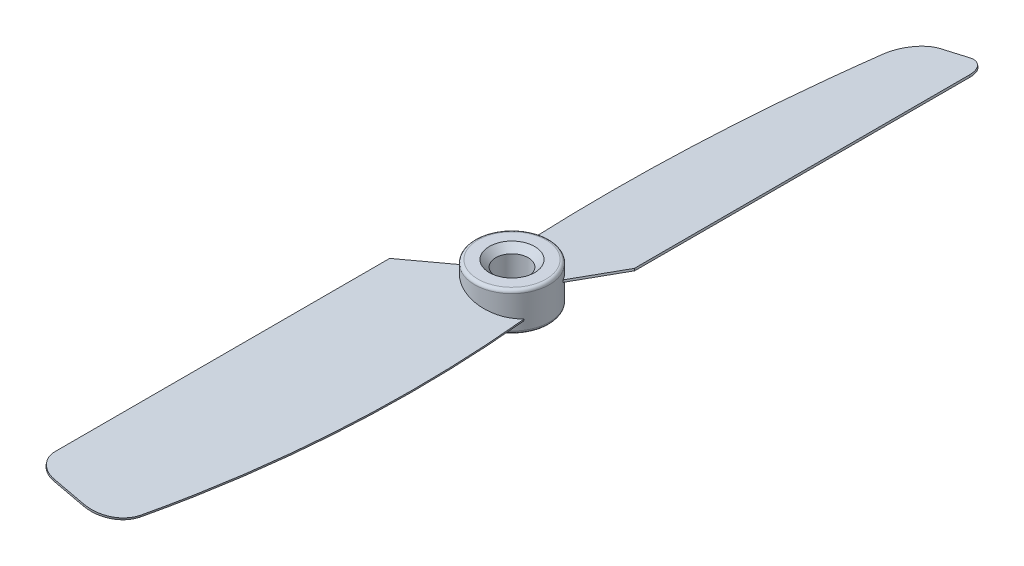
from build123d import *

# Parameters (mm, degrees)
SKETCH1_R            = 5.75
BOSS_EXTRUDE2_DEPTH  = 3
BOSS_EXTRUDE10_DEPTH = 0.15
CIRPATTERN1_COUNT    = 2
SKETCH5_R            = 2.5
CUT_EXTRUDE1_DEPTH   = 65.589571664
FILLET1_R            = 0.5
CHAMFER1_SIZE        = 1


with BuildPart() as part:
    # Sketch1 → Boss-Extrude2 (new, symmetric)
    with BuildSketch(Plane(origin=(0, 0, 0), x_dir=(1, 0, 0), z_dir=(0, 1, 0))):
        with Locations(Location((0, 0, 0), (0, 0, 270))):
            Circle(SKETCH1_R)
    extrude(amount=BOSS_EXTRUDE2_DEPTH, both=True)

    # Sketch4 → Boss-Extrude10 (add, symmetric)
    with BuildSketch(Plane(origin=(0, 0, 0), x_dir=(0.9743700647852351, -0.22495105434386553, 0), z_dir=(-0.22495105434386553, -0.9743700647852351, 0))):
        with BuildLine():
            Line((-10.409634183, 8.775037851), (-10.409634183, 60.5))
            ThreePointArc((-10.409634183, 60.5), (-9.530954526, 62.621320344), (-7.409634183, 63.5))
            Line((-7.409634183, 63.5), (-2.709478927, 63.5))
            ThreePointArc((-2.709478927, 63.5), (0.450679553, 62.374712683), (2.188403531, 59.505359351))
            add(Edge.make_bspline(
                [(4.983255085, 2.767158968), (7.368647348, 31.445436933), (2.188403531, 59.505359351)],
                knots=[0, 0, 0, 1, 1, 1], degree=2))
            ThreePointArc((4.983255085, 2.767158968), (0, 5.7), (-4.983255085, 2.767158968))
            Line((-4.983255085, 2.767158968), (-10.409634183, 8.775037851))
        make_face()
    boss_extrude10 = extrude(amount=BOSS_EXTRUDE10_DEPTH, both=True)

    # CirPattern1: Boss-Extrude10 ×2 about axis
    cirpattern1_axis = Axis((0, 3, 0), (0, -1, 0))
    for i in range(1, CIRPATTERN1_COUNT):
        add(boss_extrude10.rotate(cirpattern1_axis, i * 360 / CIRPATTERN1_COUNT))

    # Sketch5 → Cut-Extrude1 (cut, through all)
    with BuildSketch(Plane.XZ.offset(3)):
        with Locations(Location((0, 0, 0), (0, 0, 270))):
            Circle(SKETCH5_R)
    extrude(amount=-CUT_EXTRUDE1_DEPTH, mode=Mode.SUBTRACT)

    # Fillet1
    fillet1_edges = [part.edges().sort_by_distance(p)[0] for p in [
        (0, -3, -5.75),
        (0, 3, -5.75),
    ]]
    fillet(fillet1_edges, radius=FILLET1_R)

    # Chamfer1
    chamfer1_edges = [part.edges().sort_by_distance(p)[0] for p in [
        (0, 3, 2.5),
        (0, -3, 2.5),
    ]]
    chamfer(chamfer1_edges, length=CHAMFER1_SIZE)


solid = part.part
